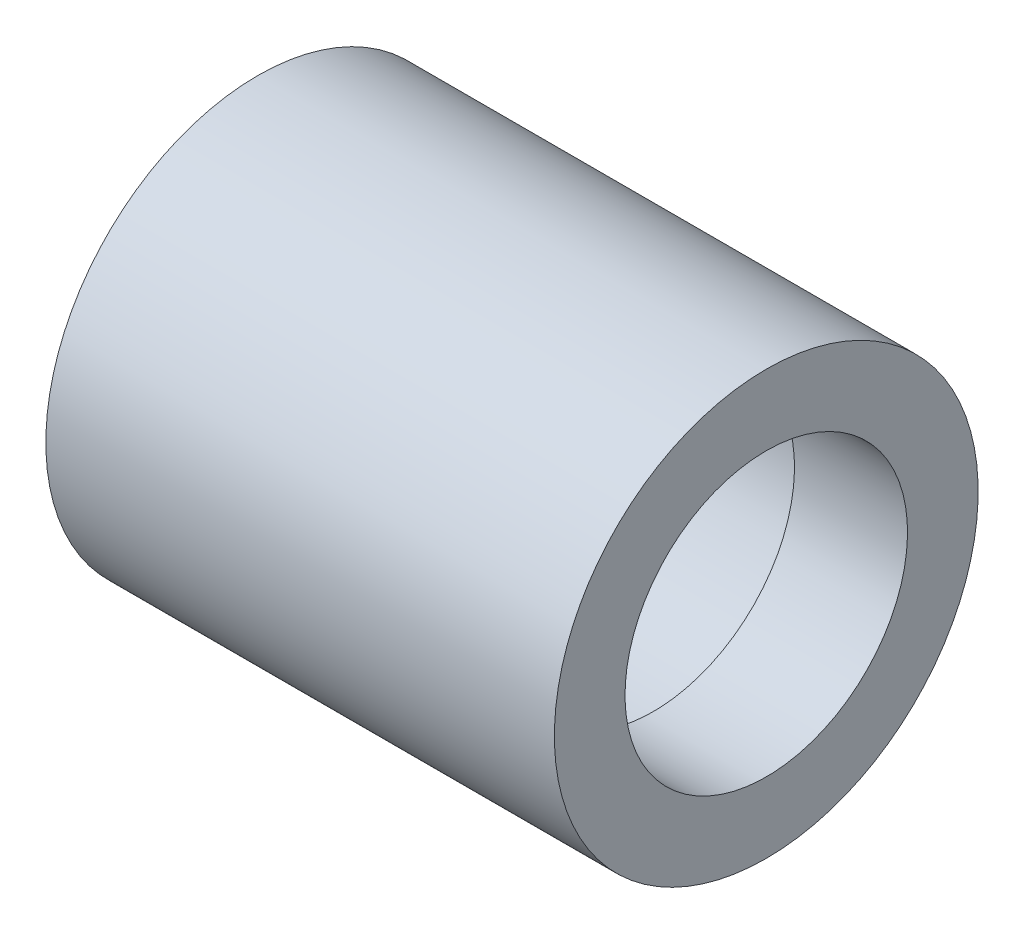
from build123d import *


with BuildPart() as part:
    # Sketch1 → Revolve1 (revolve)
    with BuildSketch(Plane.XY):
        Polygon((17, 15), (-19, 15), (-19, 10), (-9, 10), (-9, 12), (9, 12), (9, 10), (17, 10), align=None)
    revolve(axis=Axis((30.707544715, 0, 0), (-1, 0, 0)))


solid = part.part
